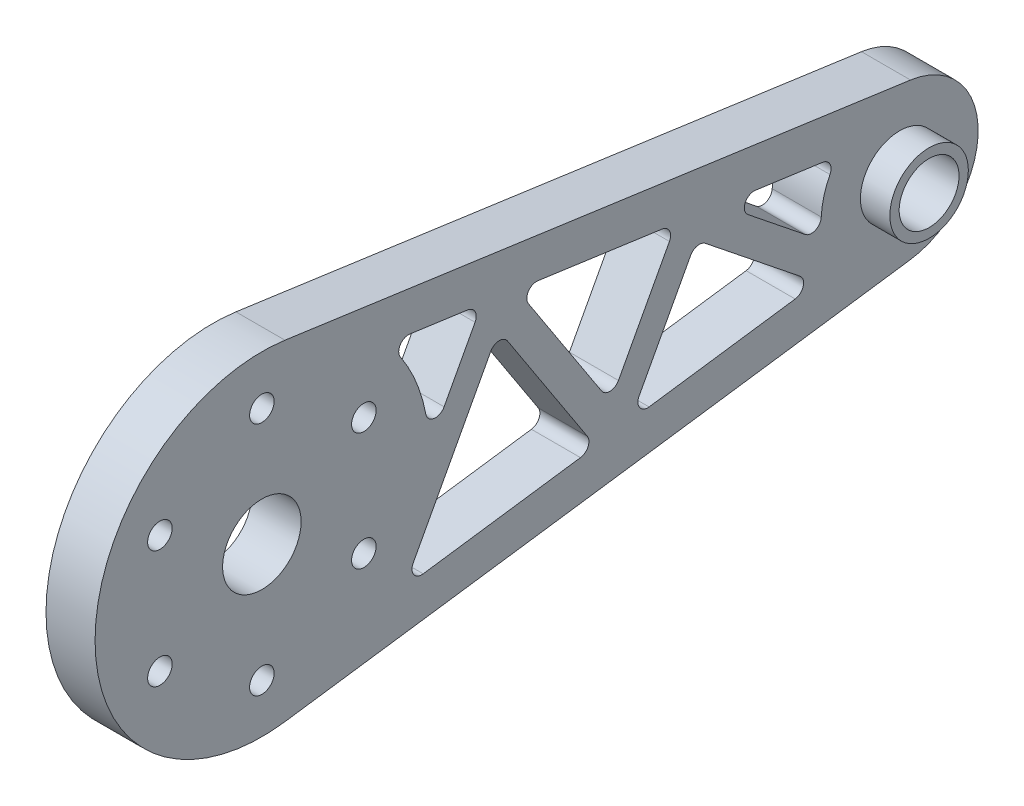
from build123d import *

# Parameters (mm, degrees)
SKETCH_1_R          = 5.1
SKETCH_1_R_2        = 1.25
SKETCH_1_R_3        = 4
EXTRUDE_1_DEPTH     = 5
EXTRUDE_START       = -5
SKETCH_3_R          = 5.1
SKETCH_3_R_2        = 3.05
EXTRUDE_2_DEPTH     = 5
CUT_EXTRUDE_START   = -39
CUT_EXTRUDE_1_DEPTH = 39
FILLET_1_R          = 1
SKETCH_5_R          = 4
SKETCH_5_R_2        = 3.05
EXTRUDE_3_DEPTH     = 3
EXTRUDE_START_2     = -8
SKETCH_5_2_R        = 4
SKETCH_5_2_R_2      = 3.05
EXTRUDE_4_DEPTH     = 3


with BuildPart() as part:
    # 草图1 → 凸台-拉伸1 (new body)
    with BuildSketch(Plane(origin=(0, 0, 0), x_dir=(0, 0, -1), z_dir=(1, 0, 0))):
        with BuildLine():
            Line((-62.646153846, 16.836252798), (1.107692308, 7.922942493))
            ThreePointArc((1.107692308, 7.922942493), (8, 0), (1.107692308, -7.922942493))
            Line((1.107692308, -7.922942493), (-62.646153846, -16.836252798))
            ThreePointArc((-62.646153846, -16.836252798), (-82, 0), (-62.646153846, 16.836252798))
        make_face()
        Circle(SKETCH_1_R, mode=Mode.SUBTRACT)
        with Locations((-65, 12)):
            Circle(SKETCH_1_R_2, mode=Mode.SUBTRACT)
        with Locations((-54.607695155, 6)):
            Circle(SKETCH_1_R_2, mode=Mode.SUBTRACT)
        with Locations((-54.607695155, -6)):
            Circle(SKETCH_1_R_2, mode=Mode.SUBTRACT)
        with Locations((-65, -12)):
            Circle(SKETCH_1_R_2, mode=Mode.SUBTRACT)
        with Locations((-75.392304845, -6)):
            Circle(SKETCH_1_R_2, mode=Mode.SUBTRACT)
        with Locations((-75.392304845, 6)):
            Circle(SKETCH_1_R_2, mode=Mode.SUBTRACT)
        with Locations((-65, 0)):
            Circle(SKETCH_1_R_3, mode=Mode.SUBTRACT)
    extrude(amount=EXTRUDE_1_DEPTH)

    # 草图3 → 凸台-拉伸2 (add)
    with BuildSketch(Plane(origin=(5, 0, 0), x_dir=(0, 0, -1), z_dir=(1, 0, 0)).offset(EXTRUDE_START)):
        Circle(SKETCH_3_R)
        Circle(SKETCH_3_R_2, mode=Mode.SUBTRACT)
    extrude(amount=EXTRUDE_2_DEPTH)

    # 草图4 → 切除-拉伸1 (cut)
    with BuildSketch(Plane(origin=(5, 0, 0), x_dir=(0, 0, -1), z_dir=(1, 0, 0)).offset(CUT_EXTRUDE_START)):
        with BuildLine():
            ThreePointArc((-52.351064187, 11.358011392), (-49.11043892, 6.043330927), (-48.000195865, -0.081605066))
            Line((-48.000195865, -0.081605066), (-42.591700786, 9.993572388))
            Line((-42.591700786, 9.993572388), (-52.351064187, 11.358011392))
        make_face()
        Polygon((-40.882941228, 6.833880199), (-50.510462108, -11.100680134), (-30.970429949, -8.368823461), align=None)
        Polygon((-22.784344553, 7.224341619), (-39.037796468, 9.496707432), (-29.454491818, -5.201095838), align=None)
        Polygon((-20.73145487, 4.70570984), (-27.488741674, -7.8820549), (-8.350862694, -5.206422539), align=None)
        with BuildLine():
            Line((-6.307623318, 4.920760925), (-18.292914034, 6.596402814))
            Line((-18.292914034, 6.596402814), (-7.792445514, -1.810467594))
            ThreePointArc((-7.792445514, -1.810467594), (-7.812192049, 1.723268809), (-6.307623318, 4.920760925))
        make_face()
    extrude(amount=CUT_EXTRUDE_1_DEPTH, mode=Mode.SUBTRACT)

    # 圆角1
    fillet_1_edges = [part.edges().sort_by_distance(p)[0] for p in [
        (2.5, -5.201095838, 29.454491818),
        (2.5, 9.496707432, 39.037796468),
        (2.5, 7.224341619, 22.784344553),
        (2.5, -11.100680134, 50.510462108),
        (2.5, 6.833880199, 40.882941228),
        (2.5, -8.368823461, 30.970429949),
        (2.5, 4.920760925, 6.307623318),
        (2.5, -1.810467594, 7.792445514),
        (2.5, 6.596402814, 18.292914034),
        (2.5, 4.70570984, 20.73145487),
        (2.5, -5.206422539, 8.350862694),
        (2.5, -7.8820549, 27.488741674),
        (2.5, -0.081605066, 48.000195865),
        (2.5, 11.358011392, 52.351064187),
        (2.5, 9.993572388, 42.591700786),
    ]]
    fillet(fillet_1_edges, radius=FILLET_1_R)

    # 草图5 → 凸台-拉伸3 (add)
    with BuildSketch(Plane(origin=(5, 0, 0), x_dir=(0, 0, -1), z_dir=(1, 0, 0))):
        Circle(SKETCH_5_R)
        Circle(SKETCH_5_R_2, mode=Mode.SUBTRACT)
    extrude(amount=EXTRUDE_3_DEPTH)

    # 草图5<2> → 凸台-拉伸4 (add)
    with BuildSketch(Plane(origin=(5, 0, 0), x_dir=(0, 0, -1), z_dir=(1, 0, 0)).offset(EXTRUDE_START_2)):
        Circle(SKETCH_5_2_R)
        Circle(SKETCH_5_2_R_2, mode=Mode.SUBTRACT)
    extrude(amount=EXTRUDE_4_DEPTH)


solid = part.part
